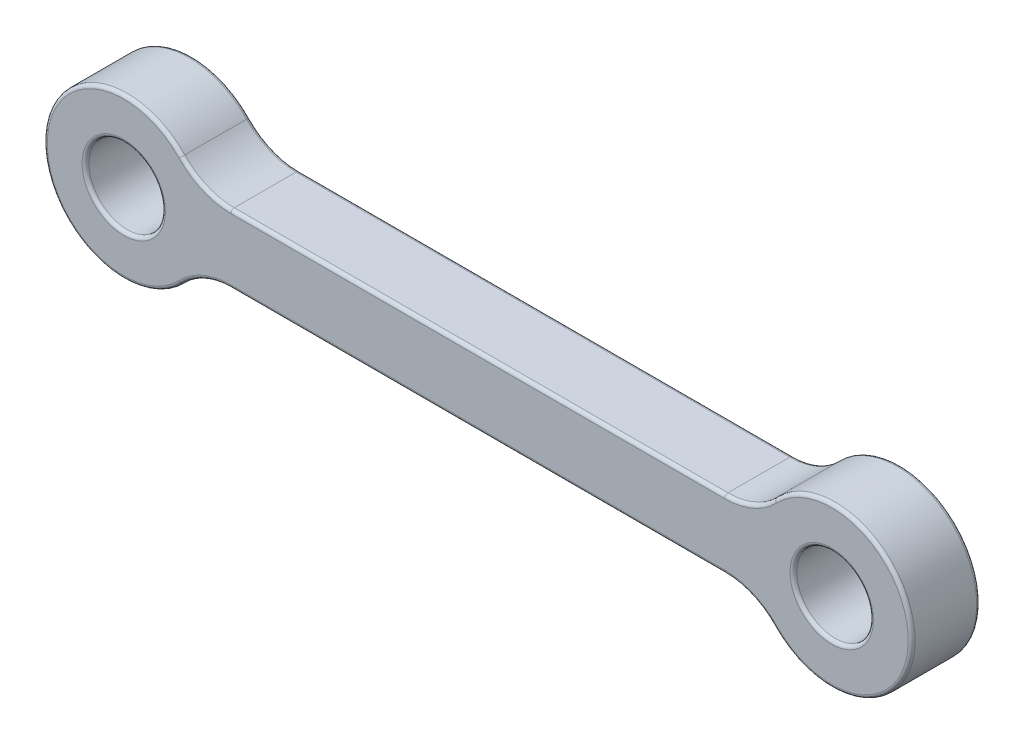
from build123d import *

# Parameters (mm, degrees)
SKETCH1_R           = 3.5
SKETCH1_R_2         = 1.675
BOSS_EXTRUDE1_DEPTH = 1.5
FILLET1_R           = 3
FILLET2_R           = 0.15


with BuildPart() as part:
    # Sketch1 → Boss-Extrude1 (new, symmetric)
    # profile 1 of 3: a face of its own
    with BuildSketch(Plane.XY):
        Circle(SKETCH1_R)
        Circle(SKETCH1_R_2, mode=Mode.SUBTRACT)
    # profile 2 of 3: a face of its own
    with BuildSketch(Plane.XY):
        with BuildLine():
            Line((3.16227766, -1.5), (27.83772234, -1.5))
            ThreePointArc((27.83772234, -1.5), (27.5, 0), (27.83772234, 1.5))
            Line((27.83772234, 1.5), (3.16227766, 1.5))
            ThreePointArc((3.16227766, 1.5), (3.414525722, 0.768774411), (3.5, 0))
            ThreePointArc((3.5, 0), (3.414525722, -0.768774411), (3.16227766, -1.5))
        make_face()
    # profile 3 of 3: a face of its own
    with BuildSketch(Plane.XY):
        with Locations((31, 0)):
            Circle(SKETCH1_R)
        with Locations((31, 0)):
            Circle(SKETCH1_R_2, mode=Mode.SUBTRACT)
    extrude(amount=BOSS_EXTRUDE1_DEPTH, both=True)

    # Fillet1
    fillet1_edges = [part.edges().sort_by_distance(p)[0] for p in [
        (27.83772234, 1.5, 0),
        (27.83772234, -1.5, 0),
        (3.16227766, -1.5, 0),
        (3.16227766, 1.5, 0),
    ]]
    fillet(fillet1_edges, radius=FILLET1_R)

    # Fillet2
    fillet2_edges = [part.edges().sort_by_distance(p)[0] for p in [
        (-3.5, 0, -1.5),
        (-1.675, 0, 1.5),
        (-3.5, 0, 1.5),
        (15.5, 1.5, -1.5),
        (15.5, 1.5, 1.5),
        (29.325, 0, 1.5),
        (34.5, 0, -1.5),
        (34.5, 0, 1.5),
        (15.5, -1.5, -1.5),
        (15.5, -1.5, 1.5),
        (3.513718949, 1.740401367, -1.5),
        (3.513718949, 1.740401367, 1.5),
        (27.486281051, 1.740401367, -1.5),
        (27.486281051, 1.740401367, 1.5),
        (3.513718949, -1.740401367, -1.5),
        (3.513718949, -1.740401367, 1.5),
        (27.486281051, -1.740401367, -1.5),
        (27.486281051, -1.740401367, 1.5),
        (29.325, 0, -1.5),
        (-1.675, 0, -1.5),
    ]]
    fillet(fillet2_edges, radius=FILLET2_R)


solid = part.part
